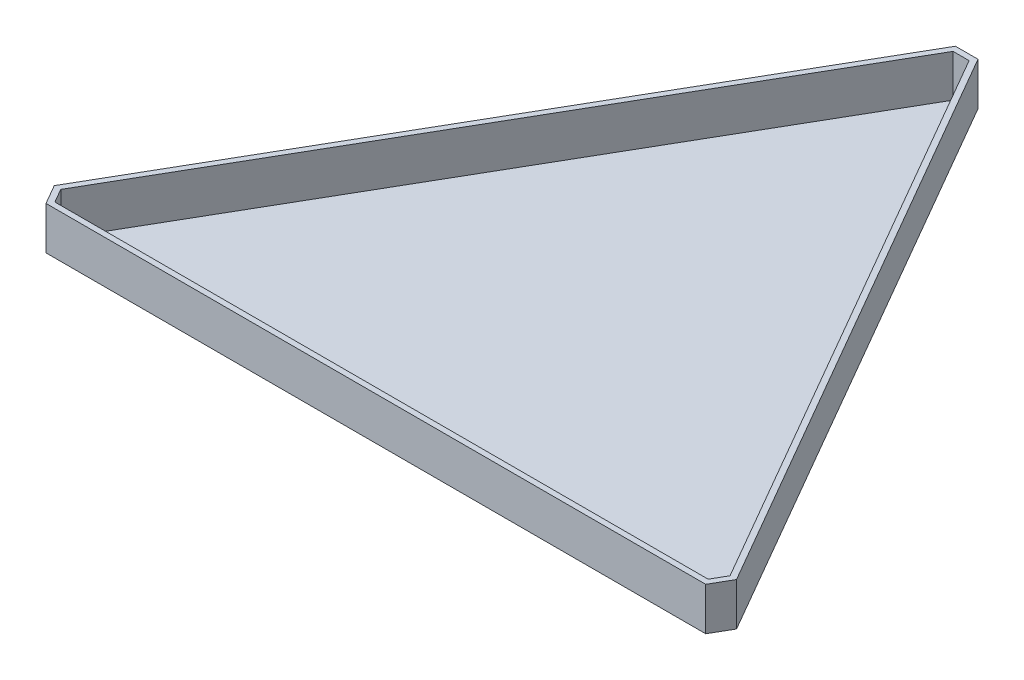
from build123d import *

# Parameters (mm, degrees)
BOSS_EXTRUDE6_DEPTH = 0.2
BOSS_EXTRUDE8_DEPTH = 15.2


with BuildPart() as part:
    # Sketch1 → Boss-Extrude6 (new body)
    with BuildSketch(Plane(origin=(0, 0, 0), x_dir=(1, 0, 0), z_dir=(0, 1, 0))):
        Polygon((351.272917769, 67.665499075), (468.273000096, -134.984588004), (464.273241085, -141.912373829), (230.273290915, -141.912373829), (226.272682949, -134.984246141), (343.272757546, 67.665499075), align=None)
    extrude(amount=BOSS_EXTRUDE6_DEPTH)

    # Sketch1<7> → Boss-Extrude8 (add)
    with BuildSketch(Plane(origin=(0, 0, 0), x_dir=(1, 0, 0), z_dir=(0, 1, 0))):
        Polygon((351.272917769, 67.665499075), (468.273000096, -134.984588004), (464.273241085, -141.912373829), (230.273290915, -141.912373829), (226.272682949, -134.984246141), (343.272757546, 67.665499075), align=None)
        Polygon((231.427991453, -139.912373829), (463.118576698, -139.912436444), (465.963671321, -134.984588004), (350.118252434, 65.665563332), (344.427420986, 65.665563332), (228.58200795, -134.984248572), align=None, mode=Mode.SUBTRACT)
    extrude(amount=BOSS_EXTRUDE8_DEPTH)


solid = part.part
